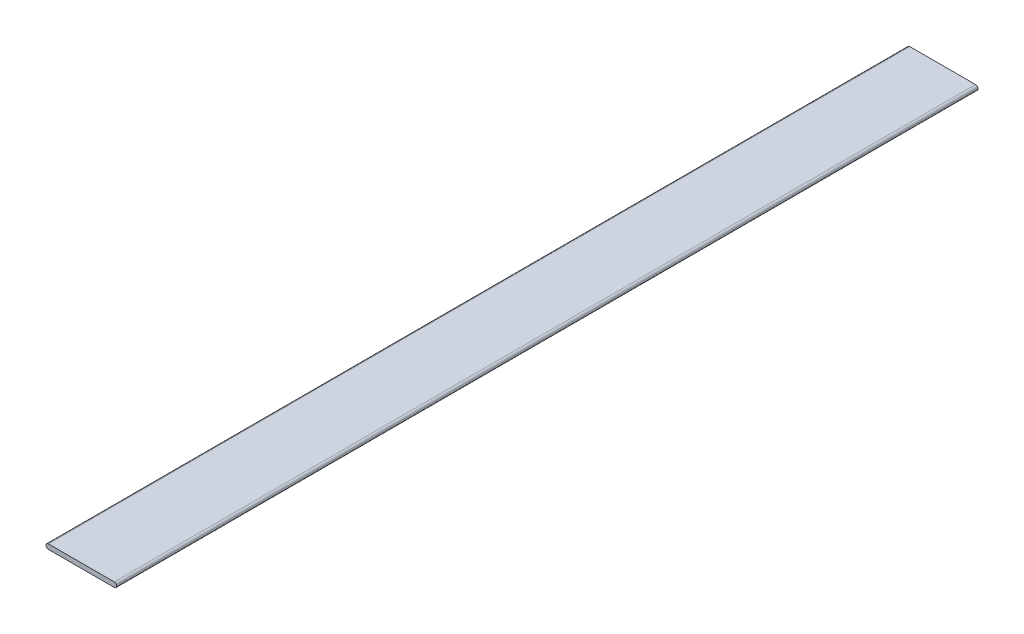
from build123d import *

# Parameters (mm, degrees)
BOSS_EXTRUDE1_DEPTH = 250


with BuildPart() as part:
    # Sketch1 → Boss-Extrude1 (new body)
    with BuildSketch(Plane.XY):
        with BuildLine():
            Line((-5.407246377, 0.7), (13.692753623, 0.7))
            ThreePointArc((13.692753623, 0.7), (14.392753623, 0), (13.692753623, -0.7))
            Line((13.692753623, -0.7), (-5.407246377, -0.7))
            ThreePointArc((-5.407246377, -0.7), (-6.107246377, 0), (-5.407246377, 0.7))
        make_face()
    extrude(amount=BOSS_EXTRUDE1_DEPTH)


solid = part.part
